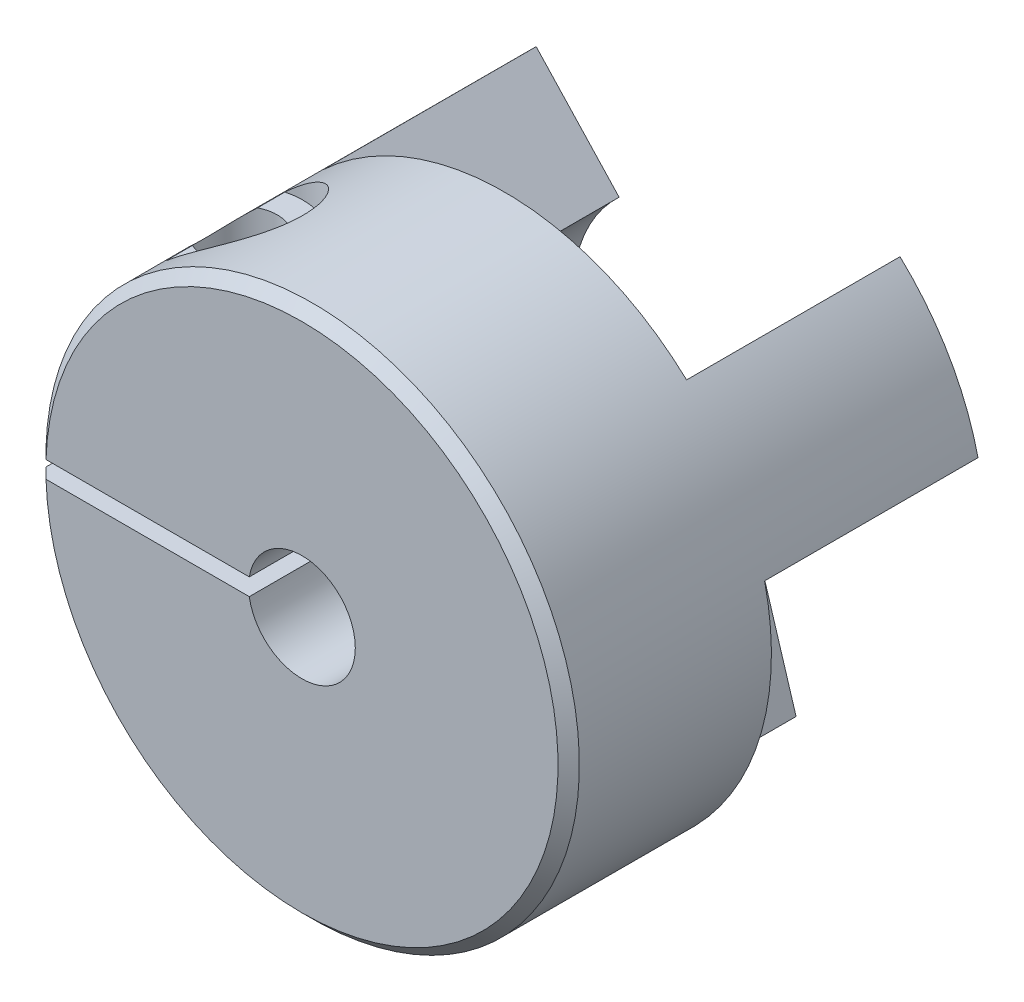
from build123d import *
from build123d.topology import SkipClean

# Parameters (mm, degrees)
SKETCH1_W                                        = 12.5
SKETCH1_H                                        = 19.5
CUT_EXTRUDE1_START                               = -10
CUT_EXTRUDE1_DEPTH                               = 10
BOSS_EXTRUDE1_DEPTH                              = 10
BOSS_EXTRUDE2_DEPTH                              = 10
CUT_EXTRUDE2_DEPTH                               = 21.310096012
SKETCH6_W                                        = 2.5
SKETCH6_H                                        = 9.5
CBORE_FOR_M3_HEX_HEAD_MACHINE_SCREW1_D           = 3.4
CBORE_FOR_M3_HEX_HEAD_MACHINE_SCREW1_DEPTH       = 11.182745788
CBORE_FOR_M3_HEX_HEAD_MACHINE_SCREW1_CBORE_D     = 5.8
CBORE_FOR_M3_HEX_HEAD_MACHINE_SCREW1_CBORE_DEPTH = 2.282745788
F_2_5_2_5_DIAMETER_HOLE1_D                       = 2.5
F_2_5_2_5_DIAMETER_HOLE1_DEPTH                   = 12.1
CHAMFER1_SIZE                                    = 0.5


with BuildPart() as part:
    # Sketch1 → Revolve1 (revolve)
    with BuildSketch(Plane.XZ, mode=Mode.PRIVATE) as revolve1_sk:
        with Locations((6.25, 20.25)):
            Rectangle(SKETCH1_W, SKETCH1_H)
    revolve(revolve1_sk.sketch.rotate(Axis((0, 0, 30), (0, 0, -1)), 180), axis=Axis((0, 0, 30), (0, 0, -1)))

    # Sketch2 → Cut-Extrude1 (cut)
    with BuildSketch(Plane(origin=(0, 0, 10.5), x_dir=(-1, 0, 0), z_dir=(0, 0, -1)).offset(CUT_EXTRUDE1_START)):
        with BuildLine():
            Line((-3.654646309, -11.95380945), (-1.988127592, -6.502872341))
            ThreePointArc((-1.988127592, -6.502872341), (0, -6.8), (1.988127592, -6.502872341))
            Line((1.988127592, -6.502872341), (3.654646309, -11.95380945))
            ThreePointArc((3.654646309, -11.95380945), (0, 12.5), (-3.654646309, -11.95380945))
        make_face()
    extrude(amount=CUT_EXTRUDE1_DEPTH, mode=Mode.SUBTRACT)

    # Sketch3 → Boss-Extrude1 (add)
    with SkipClean():  # the faces are left unmerged after this step: merging them gives an invalid solid
        with BuildSketch(Plane(origin=(0, 0, 20.5), x_dir=(-1, 0, 0), z_dir=(0, 0, -1))):
            with BuildLine():
                Line((-6.625716441, 1.52966717), (-12.17962581, 2.811888179))
                ThreePointArc((-12.17962581, 2.811888179), (-10.825317547, 6.25), (-8.524979501, 9.14192127))
                Line((-8.524979501, 9.14192127), (-4.637588848, 4.973205171))
                ThreePointArc((-4.637588848, 4.973205171), (-5.888972746, 3.4), (-6.625716441, 1.52966717))
            make_face()
        extrude(amount=BOSS_EXTRUDE1_DEPTH)

    # Sketch4 → Boss-Extrude2 (add)
    with SkipClean():  # the faces are left unmerged after this step: merging them gives an invalid solid
        with BuildSketch(Plane(origin=(0, 0, 20.5), x_dir=(-1, 0, 0), z_dir=(0, 0, -1))):
            with BuildLine():
                Line((4.637588848, 4.973205171), (8.524979501, 9.14192127))
                ThreePointArc((8.524979501, 9.14192127), (10.825317547, 6.25), (12.17962581, 2.811888179))
                Line((12.17962581, 2.811888179), (6.625716441, 1.52966717))
                ThreePointArc((6.625716441, 1.52966717), (5.888972746, 3.4), (4.637588848, 4.973205171))
            make_face()
        extrude(amount=BOSS_EXTRUDE2_DEPTH)

    # Sketch5 → Cut-Extrude2 (cut, through all)
    with SkipClean():  # the faces are left unmerged after this step: merging them gives an invalid solid
        with BuildSketch(Plane(origin=(0, 0, 20.5), x_dir=(-1, 0, 0), z_dir=(0, 0, -1))):
            with BuildLine():
                Line((12.493598361, 0.4), (2.467792536, 0.4))
                ThreePointArc((2.467792536, 0.4), (2.5, 0), (2.467792536, -0.4))
                Line((2.467792536, -0.4), (12.493598361, -0.4))
                ThreePointArc((12.493598361, -0.4), (12.5, 0), (12.493598361, 0.4))
            make_face()
        extrude(amount=-CUT_EXTRUDE2_DEPTH, mode=Mode.SUBTRACT)

    # Sketch6 → Cut-Revolve1 (revolve, cut)
    with SkipClean():  # the faces are left unmerged after this step: merging them gives an invalid solid
        with BuildSketch(Plane.XZ):
            with Locations((1.25, 25.25)):
                Rectangle(SKETCH6_W, SKETCH6_H)
        revolve(axis=Axis((0, 0, 30), (0, 0, -1)), mode=Mode.SUBTRACT)

    # CBORE for M3 Hex Head Machine Screw1
    with Locations(Plane(origin=(0, 11.582745788, 0), x_dir=(1, 0, 0), z_dir=(0, 1, 0))):
        with Locations((-7.6, -25.25)):
            CounterBoreHole(CBORE_FOR_M3_HEX_HEAD_MACHINE_SCREW1_D / 2, CBORE_FOR_M3_HEX_HEAD_MACHINE_SCREW1_CBORE_D / 2, CBORE_FOR_M3_HEX_HEAD_MACHINE_SCREW1_CBORE_DEPTH, depth=CBORE_FOR_M3_HEX_HEAD_MACHINE_SCREW1_DEPTH)

    # Ø2.5 (2.5) Diameter Hole1
    with Locations(Plane(origin=(0, -0.4, 0), x_dir=(1, 0, 0), z_dir=(0, 1, 0))):
        with Locations((-7.6, -25.25)):
            Hole(F_2_5_2_5_DIAMETER_HOLE1_D / 2, depth=F_2_5_2_5_DIAMETER_HOLE1_DEPTH)

    # Chamfer1
    chamfer1_edges = [part.edges().sort_by_distance(p)[0] for p in [
        (12.5, 0, 30),
    ]]
    chamfer(chamfer1_edges, length=CHAMFER1_SIZE)


solid = part.part
